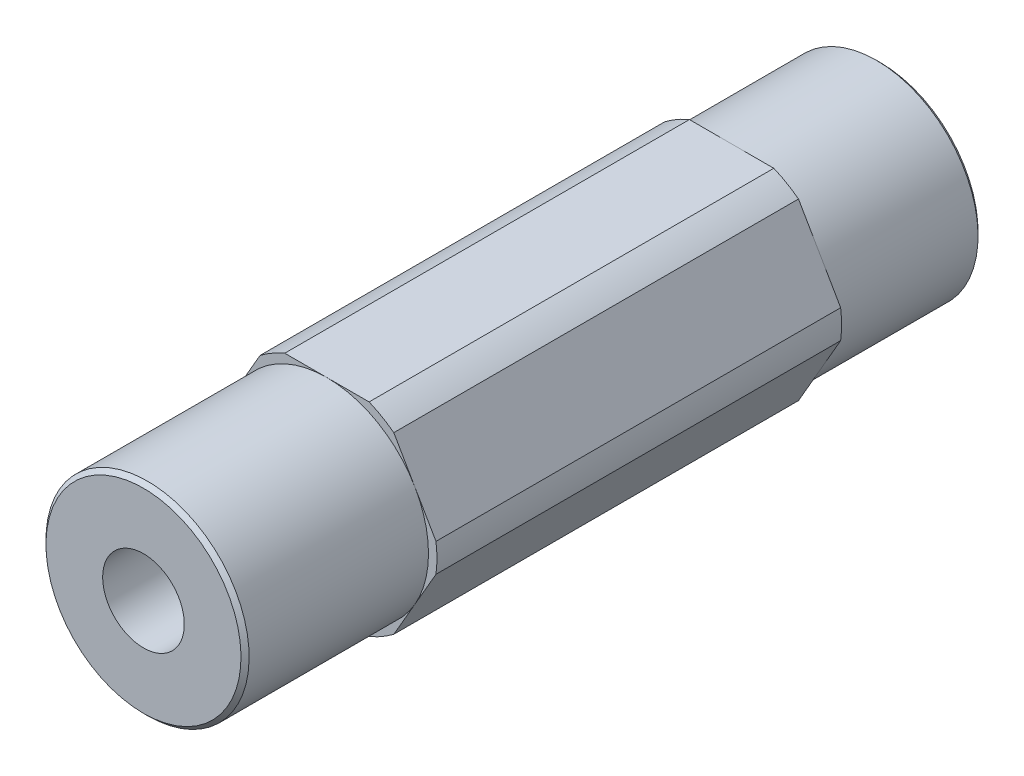
from build123d import *

# Parameters (mm, degrees)
SKETCH2_OUTSIDE_W  = 25.754
SKETCH2_OUTSIDE_H  = 25.754
SKETCH2_OUTSIDE_R  = 2.5527
CUT_EXTRUDE3_DEPTH = 48.090483291
CHAMFER1_SIZE      = 0.254


with BuildPart() as part:
    # Sketch1 → Revolve1 (revolve)
    with BuildSketch(Plane(origin=(0, 0, 0), x_dir=(0, 0, -1), z_dir=(1, 0, 0))):
        Polygon((0, 0), (-46.0756, 0), (-46.0756, 6.35), (-34.6075, 6.35), (-34.6075, 6.87578), (-9.3091, 6.87578), (-9.3091, 6.35), (0, 6.35), align=None)
    revolve(axis=Axis((0, 0, -29.540514156), (0, 0, 1)))

    # Sketch2 outside → Cut-Extrude3 (cut, through all)
    # profile 1 of 2: a face of its own
    with BuildSketch(Plane(origin=(0, 0, 0), x_dir=(-1, 0, 0), z_dir=(0, 0, -1))):
        Rectangle(SKETCH2_OUTSIDE_W, SKETCH2_OUTSIDE_H)
        Polygon((3.666174209, -6.35), (7.332348419, 0), (3.666174209, 6.35), (-3.666174209, 6.35), (-7.332348419, 0), (-3.666174209, -6.35), align=None, mode=Mode.SUBTRACT)
    # profile 2 of 2: a face of its own
    with BuildSketch(Plane(origin=(0, 0, 0), x_dir=(-1, 0, 0), z_dir=(0, 0, -1))):
        Circle(SKETCH2_OUTSIDE_R)
    extrude(amount=-CUT_EXTRUDE3_DEPTH, mode=Mode.SUBTRACT)

    # Chamfer1
    chamfer1_edges = [part.edges().sort_by_distance(p)[0] for p in [
        (0, -6.35, 0),
        (0, -6.35, 46.0756),
    ]]
    chamfer(chamfer1_edges, length=CHAMFER1_SIZE)


solid = part.part
